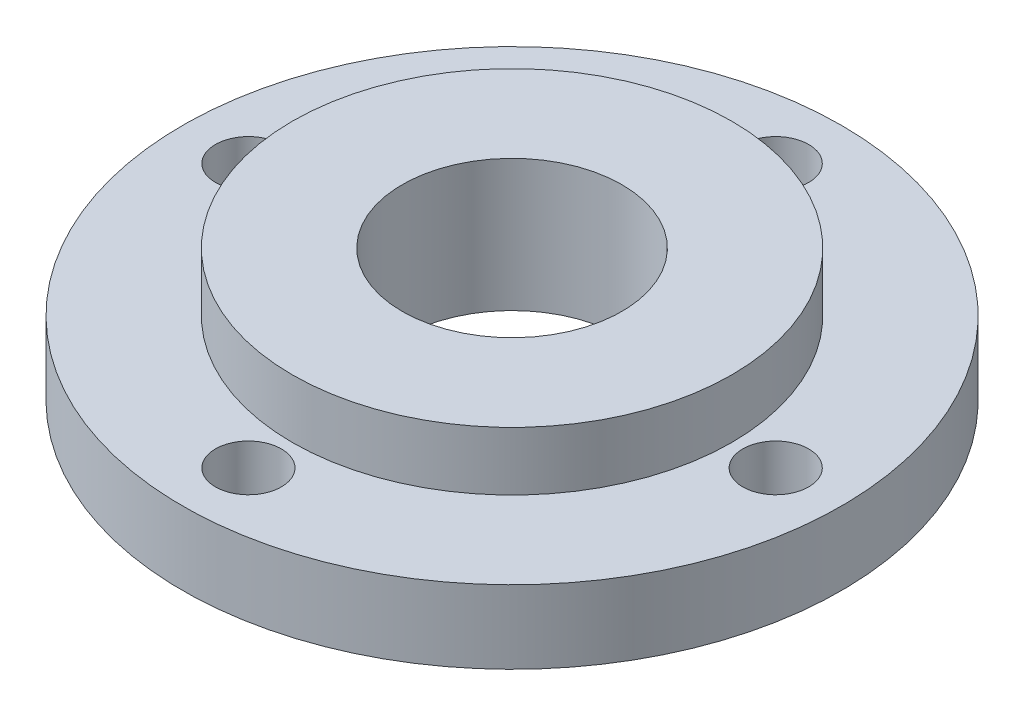
from build123d import *

# Parameters (mm, degrees)
SKETCH_2_R          = 4.5
CUT_EXTRUDE_1_DEPTH = 67.136223055


with BuildPart() as part:
    # 草图1 → 旋转1 (revolve)
    with BuildSketch(Plane.XY, mode=Mode.PRIVATE) as revolve_1_sk:
        Polygon((15, 0), (45, 0), (45, 10), (30, 10), (30, 18), (15, 18), align=None)
    revolve(revolve_1_sk.sketch.rotate(Axis((0, -10, 0), (0, 1, 0)), 90), axis=Axis((0, -10, 0), (0, 1, 0)))

    # 草图2 → 切除-拉伸1 (cut, through all)
    with BuildSketch(Plane(origin=(0, 0, 0), x_dir=(1, 0, 0), z_dir=(0, 1, 0))):
        with Locations(Location((36, 0, 0), (0, 0, 270))):
            Circle(SKETCH_2_R)
        with Locations(Location((0, 36, 0), (0, 0, 270))):
            Circle(SKETCH_2_R)
        with Locations(Location((-36, 0, 0), (0, 0, 270))):
            Circle(SKETCH_2_R)
        with Locations(Location((0, -36, 0), (0, 0, 270))):
            Circle(SKETCH_2_R)
    extrude(amount=CUT_EXTRUDE_1_DEPTH, mode=Mode.SUBTRACT)


solid = part.part
